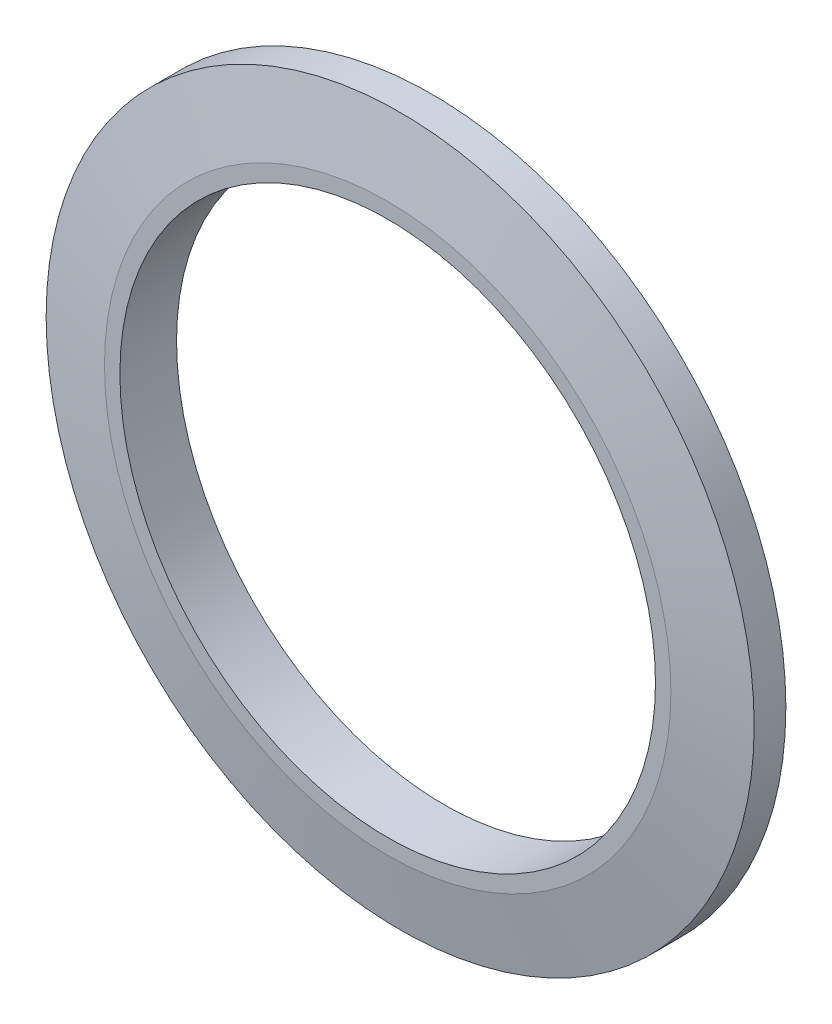
from build123d import *

# Parameters (mm, degrees)
SKETCH1_R           = 12.5
BOSS_EXTRUDE1_DEPTH = 2
SKETCH2_R           = 9.455
CUT_EXTRUDE1_DEPTH  = 2


with BuildPart() as part:
    # Sketch1 → Boss-Extrude1 (new body)
    with BuildSketch(Plane.XY):
        Circle(SKETCH1_R)
    extrude(amount=BOSS_EXTRUDE1_DEPTH)

    # Sketch2 → Cut-Extrude1 (cut)
    with BuildSketch(Plane.XY.offset(2)):
        Circle(SKETCH2_R)
    extrude(amount=-CUT_EXTRUDE1_DEPTH, mode=Mode.SUBTRACT)

    # Sketch3 → Cut-Revolve1 (revolve, cut)
    with BuildSketch(Plane(origin=(0, 0, 0), x_dir=(0, 0, -1), z_dir=(1, 0, 0)), mode=Mode.PRIVATE) as cut_revolve1_sk:
        Polygon((-2, 10), (-1.559182548, 12.5), (-2, 12.5), align=None)
        Polygon((-0.440817452, 12.5), (0, 12.5), (0, 10), align=None)
    revolve(cut_revolve1_sk.sketch.rotate(Axis((0, 0, -0.1), (0, 0, 1)), 90), axis=Axis((0, 0, -0.1), (0, 0, 1)), mode=Mode.SUBTRACT)


solid = part.part
